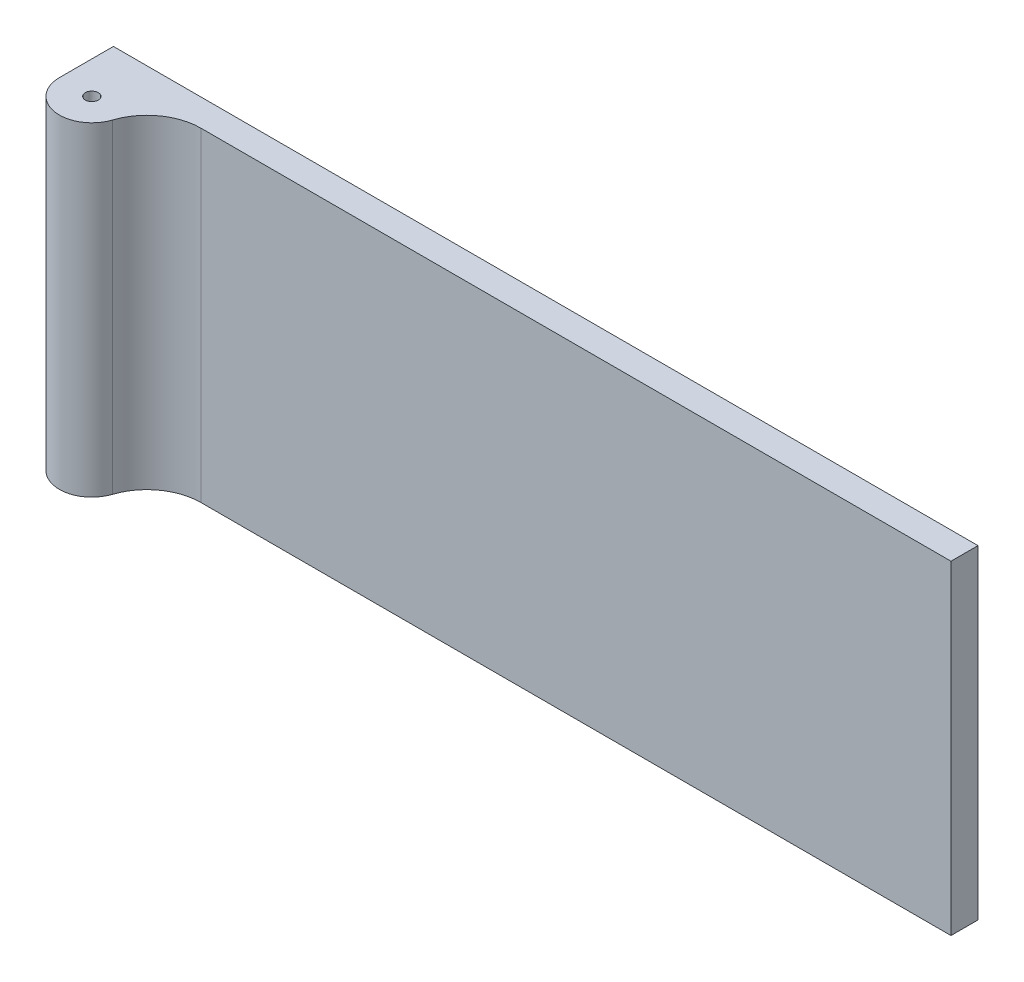
from build123d import *

# Parameters (mm, degrees)
BOSS_EXTRUDE1_DEPTH = 30
FILLET1_R           = 5


with BuildPart() as part:
    # Sketch1 → Boss-Extrude1 (new body)
    with BuildSketch(Plane(origin=(0, 0, 0), x_dir=(1, 0, 0), z_dir=(0, 1, 0))):
        with BuildLine():
            Line((80, 0), (3, 0))
            Line((3, 0), (3, -2))
            ThreePointArc((3, -2), (3.866025404, -2.127718677), (4.658312395, -2.5))
            Line((4.658312395, -2.5), (80, -2.5))
            Line((80, -2.5), (80, 0))
        make_face()
        with BuildLine():
            Line((3, -2), (3, 0))
            Line((3, 0), (0, 0))
            Line((0, 0), (0, -2.5))
            Line((0, -2.5), (1.341687605, -2.5))
            ThreePointArc((1.341687605, -2.5), (2.133974596, -2.127718677), (3, -2))
        make_face()
        with BuildLine():
            ThreePointArc((0, -5), (0.356617963, -3.581362835), (1.341687605, -2.5))
            Line((1.341687605, -2.5), (0, -2.5))
            Line((0, -2.5), (0, -5))
        make_face()
        with BuildLine():
            Line((3, -4.4), (3, -2.5))
            Line((3, -2.5), (0, -5))
            ThreePointArc((0, -5), (0.878679656, -7.121320344), (3, -8))
            Line((3, -8), (3, -5.6))
            ThreePointArc((3, -5.6), (2.4, -5), (3, -4.4))
        make_face()
        with BuildLine():
            Line((4.658312395, -2.5), (3, -2.5))
            Line((3, -2.5), (3, -4.4))
            ThreePointArc((3, -4.4), (3.424264069, -4.575735931), (3.6, -5))
            ThreePointArc((3.6, -5), (3.424264069, -5.424264069), (3, -5.6))
            Line((3, -5.6), (3, -8))
            ThreePointArc((3, -8), (5.121320344, -7.121320344), (6, -5))
            ThreePointArc((6, -5), (5.643382037, -3.581362835), (4.658312395, -2.5))
        make_face()
        with BuildLine():
            Line((0, -5), (3, -2.5))
            Line((3, -2.5), (1.341687605, -2.5))
            ThreePointArc((1.341687605, -2.5), (0.356617963, -3.581362835), (0, -5))
        make_face()
        with BuildLine():
            Line((3, -2.5), (3, -2))
            ThreePointArc((3, -2), (2.133974596, -2.127718677), (1.341687605, -2.5))
            Line((1.341687605, -2.5), (3, -2.5))
        make_face()
        with BuildLine():
            ThreePointArc((4.658312395, -2.5), (3.866025404, -2.127718677), (3, -2))
            Line((3, -2), (3, -2.5))
            Line((3, -2.5), (4.658312395, -2.5))
        make_face()
    extrude(amount=BOSS_EXTRUDE1_DEPTH)

    # Fillet1
    fillet1_edges = [part.edges().sort_by_distance(p)[0] for p in [
        (4.658312395, 15, 2.5),
    ]]
    fillet(fillet1_edges, radius=FILLET1_R)


solid = part.part
